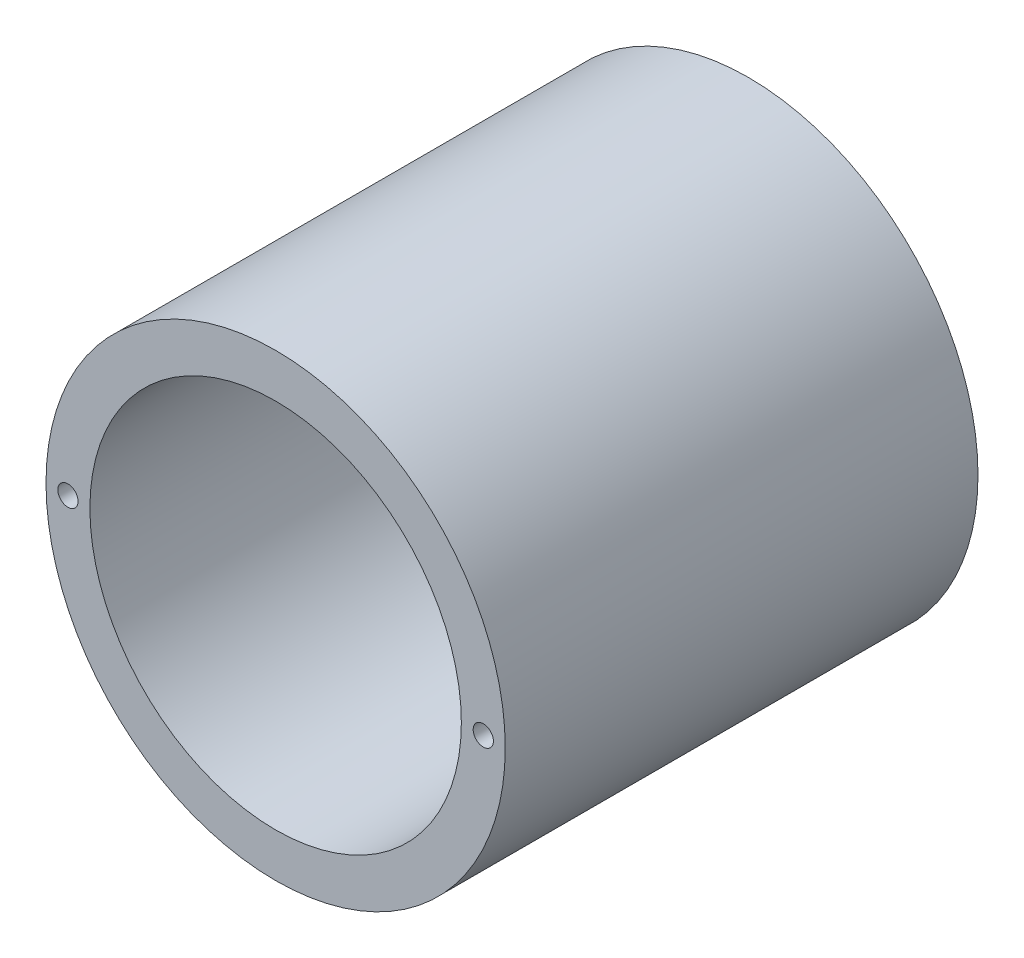
from build123d import *

# Parameters (mm, degrees)
SKETCH5_R                 = 34
BOSS_EXTRUDE1_DEPTH       = 70
SKETCH6_R                 = 27.5
CUT_EXTRUDE1_DEPTH        = 40
SKETCH7_R                 = 21.5
CUT_EXTRUDE2_DEPTH        = 10
SKETCH8_R                 = 12
CUT_EXTRUDE3_DEPTH        = 20
SKETCH9_R                 = 1.5
CUT_EXTRUDE4_DEPTH        = 20
M5X0_8_TAPPED_HOLE1_D     = 4.2
M5X0_8_TAPPED_HOLE1_DEPTH = 10
M5X0_8_TAPPED_HOLE1_TIP   = 1.2618073


with BuildPart() as part:
    # Sketch5 → Boss-Extrude1 (new body)
    with BuildSketch(Plane.XY):
        Circle(SKETCH5_R)
    extrude(amount=BOSS_EXTRUDE1_DEPTH)

    # Sketch6 → Cut-Extrude1 (cut)
    with BuildSketch(Plane.XY.offset(70)):
        Circle(SKETCH6_R)
    extrude(amount=-CUT_EXTRUDE1_DEPTH, mode=Mode.SUBTRACT)

    # Sketch7 → Cut-Extrude2 (cut)
    with BuildSketch(Plane.XY.offset(30)):
        Circle(SKETCH7_R)
    extrude(amount=-CUT_EXTRUDE2_DEPTH, mode=Mode.SUBTRACT)

    # Sketch8 → Cut-Extrude3 (cut)
    with BuildSketch(Plane(origin=(0, 0, 0), x_dir=(-1, 0, 0), z_dir=(0, 0, -1))):
        Circle(SKETCH8_R)
    extrude(amount=-CUT_EXTRUDE3_DEPTH, mode=Mode.SUBTRACT)

    # Sketch9 → Cut-Extrude4 (cut)
    with BuildSketch(Plane.XY.offset(70)):
        with Locations((-30.75, 0)):
            Circle(SKETCH9_R)
        with Locations((30.75, 0)):
            Circle(SKETCH9_R)
    extrude(amount=-CUT_EXTRUDE4_DEPTH, mode=Mode.SUBTRACT)

    # M5x0.8 Tapped Hole1
    with Locations(Plane(origin=(0, 0, 0), x_dir=(-1, 0, 0), z_dir=(0, 0, -1))):
        with Locations((-10, 22), (10, 22), (10, -22), (-10, -22)):
            Hole(M5X0_8_TAPPED_HOLE1_D / 2, depth=M5X0_8_TAPPED_HOLE1_DEPTH)
            with Locations((0, 0, -(M5X0_8_TAPPED_HOLE1_DEPTH + M5X0_8_TAPPED_HOLE1_TIP / 2))):  # 118° drill point
                Cone(0, M5X0_8_TAPPED_HOLE1_D / 2, M5X0_8_TAPPED_HOLE1_TIP, mode=Mode.SUBTRACT)


solid = part.part
